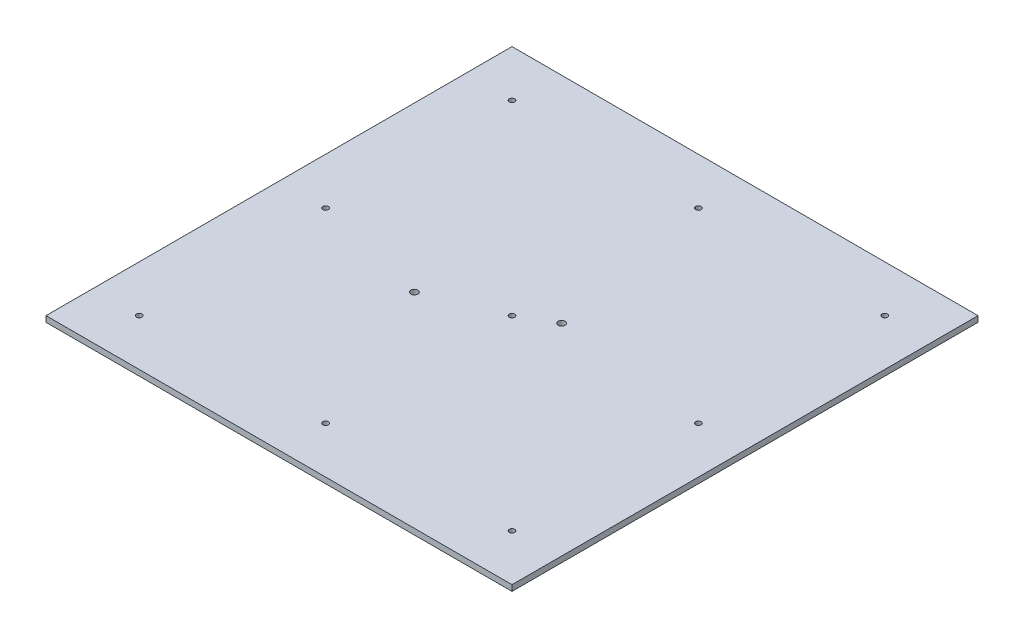
from build123d import *

# Parameters (mm, degrees)
SKETCH1_W             = 254
SKETCH1_H             = 254
BOSS_EXTRUDE1_DEPTH   = 3.175
F_3_0MM_DOWEL_HOLE1_D = 3
CUT_EXTRUDE1_DEPTH    = 180.63318353


with BuildPart() as part:
    # Sketch1 → Boss-Extrude1 (new body)
    with BuildSketch(Plane(origin=(0, 0, 0), x_dir=(1, 0, 0), z_dir=(0, 1, 0))):
        Rectangle(SKETCH1_W, SKETCH1_H)
    extrude(amount=BOSS_EXTRUDE1_DEPTH)

    # Ø3.0mm Dowel Hole1 (through all)
    with Locations(Plane.ZX.offset(3.175)):
        with Locations((0, 0), (0, -101.6), (0, 101.6), (101.6, 101.6), (101.6, 0), (101.6, -101.6), (-101.6, -101.6), (-101.6, 0), (-101.6, 101.6)):
            Hole(F_3_0MM_DOWEL_HOLE1_D / 2)

    # Sketch5 → Cut-Extrude1 (cut, through all)
    with BuildSketch(Plane(origin=(0, 3.175, 0), x_dir=(1, 0, 0), z_dir=(0, 1, 0))):
        with BuildLine():
            ThreePointArc((17.145, 11.811), (15.24, 9.906), (17.145, 8.001))
            Line((17.145, 8.001), (17.145, 9.906))
            Line((17.145, 9.906), (17.145, 11.811))
        make_face()
        with BuildLine():
            Line((17.145, 9.906), (17.145, 8.001))
            ThreePointArc((17.145, 8.001), (18.492038418, 8.558961582), (19.05, 9.906))
            Line((19.05, 9.906), (17.145, 9.906))
        make_face()
        with BuildLine():
            Line((17.145, 11.811), (17.145, 9.906))
            Line((17.145, 9.906), (19.05, 9.906))
            ThreePointArc((19.05, 9.906), (18.492038418, 11.253038418), (17.145, 11.811))
        make_face()
        with BuildLine():
            ThreePointArc((-39.624, -15.494), (-39.066038418, -16.841038418), (-37.719, -17.399))
            Line((-37.719, -17.399), (-37.719, -15.494))
            Line((-37.719, -15.494), (-39.624, -15.494))
        make_face()
        with BuildLine():
            Line((-37.719, -15.494), (-37.719, -17.399))
            ThreePointArc((-37.719, -17.399), (-36.371961582, -16.841038418), (-35.814, -15.494))
            ThreePointArc((-35.814, -15.494), (-37.719, -13.589), (-39.624, -15.494))
            Line((-39.624, -15.494), (-37.719, -15.494))
        make_face()
    extrude(amount=-CUT_EXTRUDE1_DEPTH, mode=Mode.SUBTRACT)


solid = part.part
